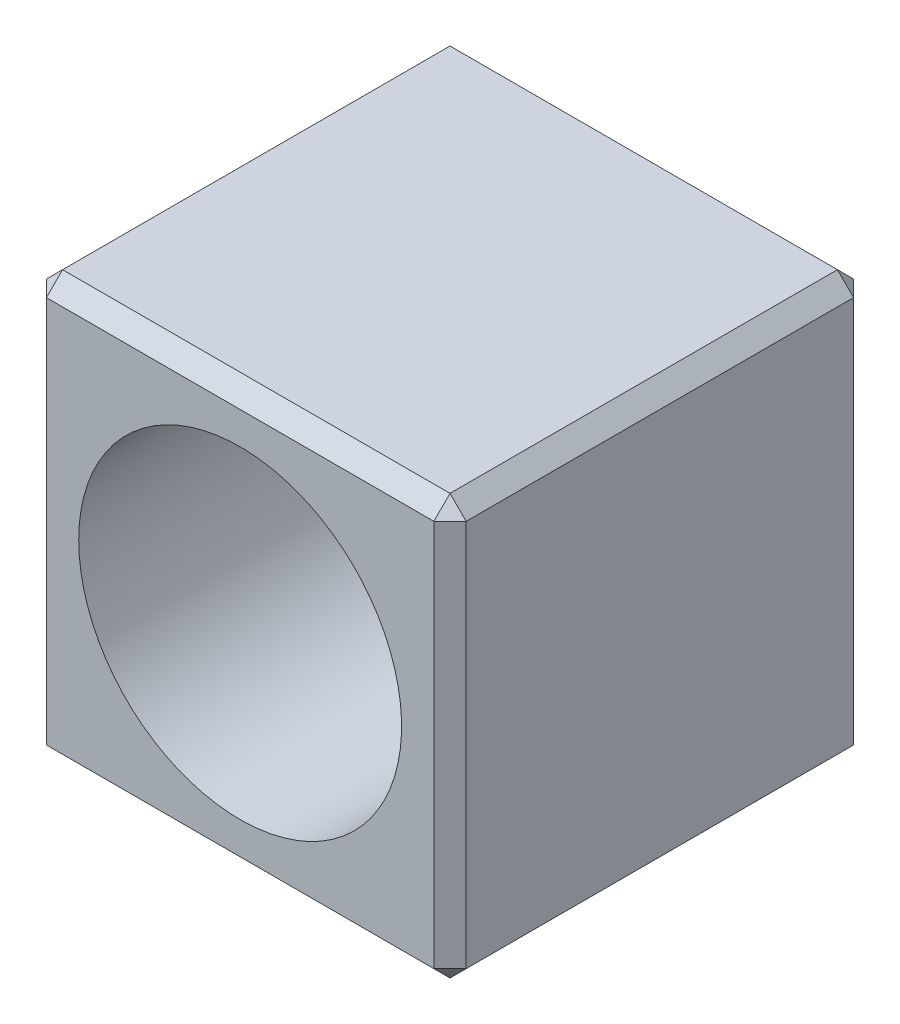
from build123d import *

# Parameters (mm, degrees)
SKETCH1_W           = 13
SKETCH1_H           = 13
SKETCH1_R           = 5
BOSS_EXTRUDE1_DEPTH = 13
CHAMFER1_SIZE       = 0.5


with BuildPart() as part:
    # Sketch1 → Boss-Extrude1 (new body)
    with BuildSketch(Plane.XY):
        Rectangle(SKETCH1_W, SKETCH1_H)
        with Locations(Location((0, 0, 0), (0, 0, 180))):
            Circle(SKETCH1_R, mode=Mode.SUBTRACT)
    extrude(amount=BOSS_EXTRUDE1_DEPTH)

    # Chamfer1
    chamfer1_edges = [part.edges().sort_by_distance(p)[0] for p in [
        (-6.5, 0, 13),
        (0, -6.5, 13),
        (6.5, 0, 13),
        (0, -6.5, 0),
        (-6.5, 0, 0),
        (0, 6.5, 0),
        (6.5, 0, 0),
        (6.5, -6.5, 6.5),
        (-6.5, -6.5, 6.5),
        (-6.5, 6.5, 6.5),
        (6.5, 6.5, 6.5),
        (0, 6.5, 13),
    ]]
    chamfer(chamfer1_edges, length=CHAMFER1_SIZE)


solid = part.part
